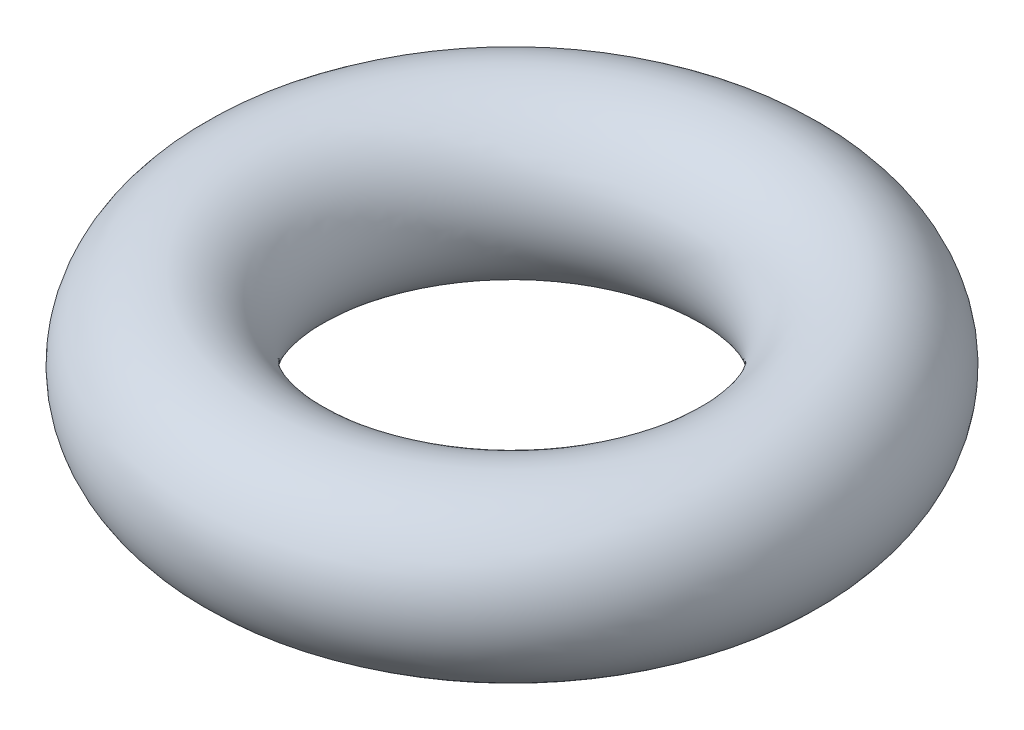
from build123d import *

# Parameters (mm, degrees)
SKETCH1_R = 2.5


with BuildPart() as part:
    # Sketch1 → Revolve1 (revolve)
    with BuildSketch(Plane.XY, mode=Mode.PRIVATE) as revolve1_sk:
        with Locations((7.5, 0)):
            Circle(SKETCH1_R)
    revolve(revolve1_sk.sketch.rotate(Axis((0, 18.964193157, 0), (0, -1, 0)), 90), axis=Axis((0, 18.964193157, 0), (0, -1, 0)))


solid = part.part
